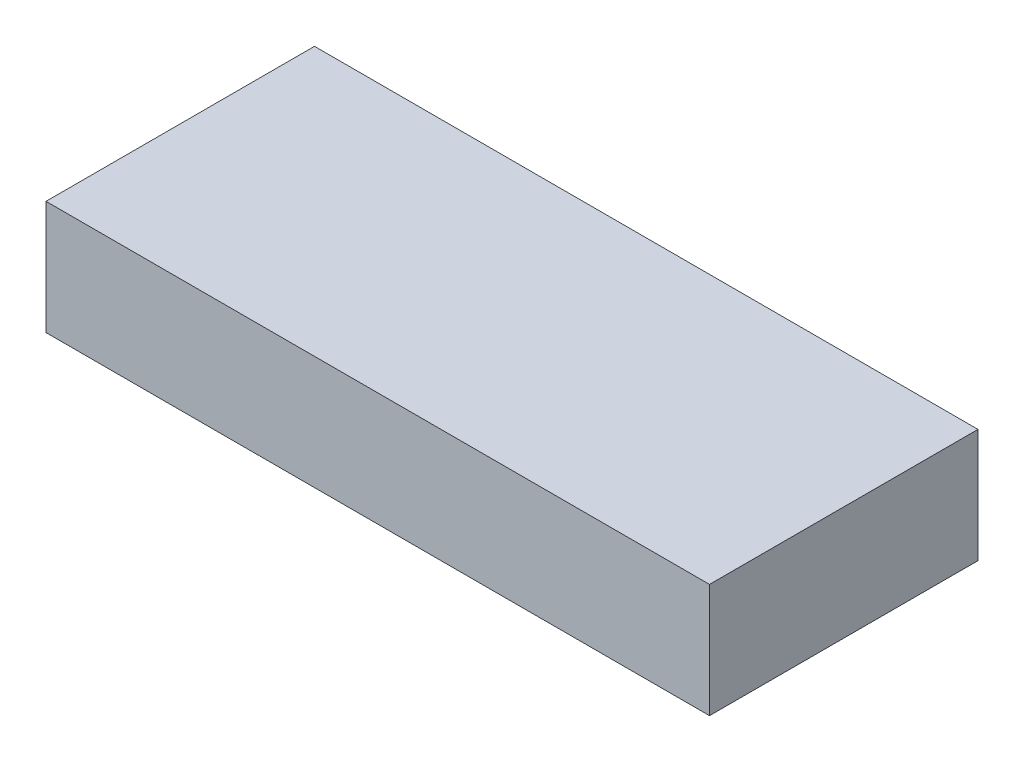
from build123d import *

# Parameters (mm, degrees)
SKETCH1_W           = 62.15
SKETCH1_H           = 25.15
BOSS_EXTRUDE1_DEPTH = 10.65


with BuildPart() as part:
    # Sketch1 → Boss-Extrude1 (new body)
    with BuildSketch(Plane(origin=(0, 0, 0), x_dir=(1, 0, 0), z_dir=(0, 1, 0))):
        Rectangle(SKETCH1_W, SKETCH1_H)
    extrude(amount=BOSS_EXTRUDE1_DEPTH)


solid = part.part
